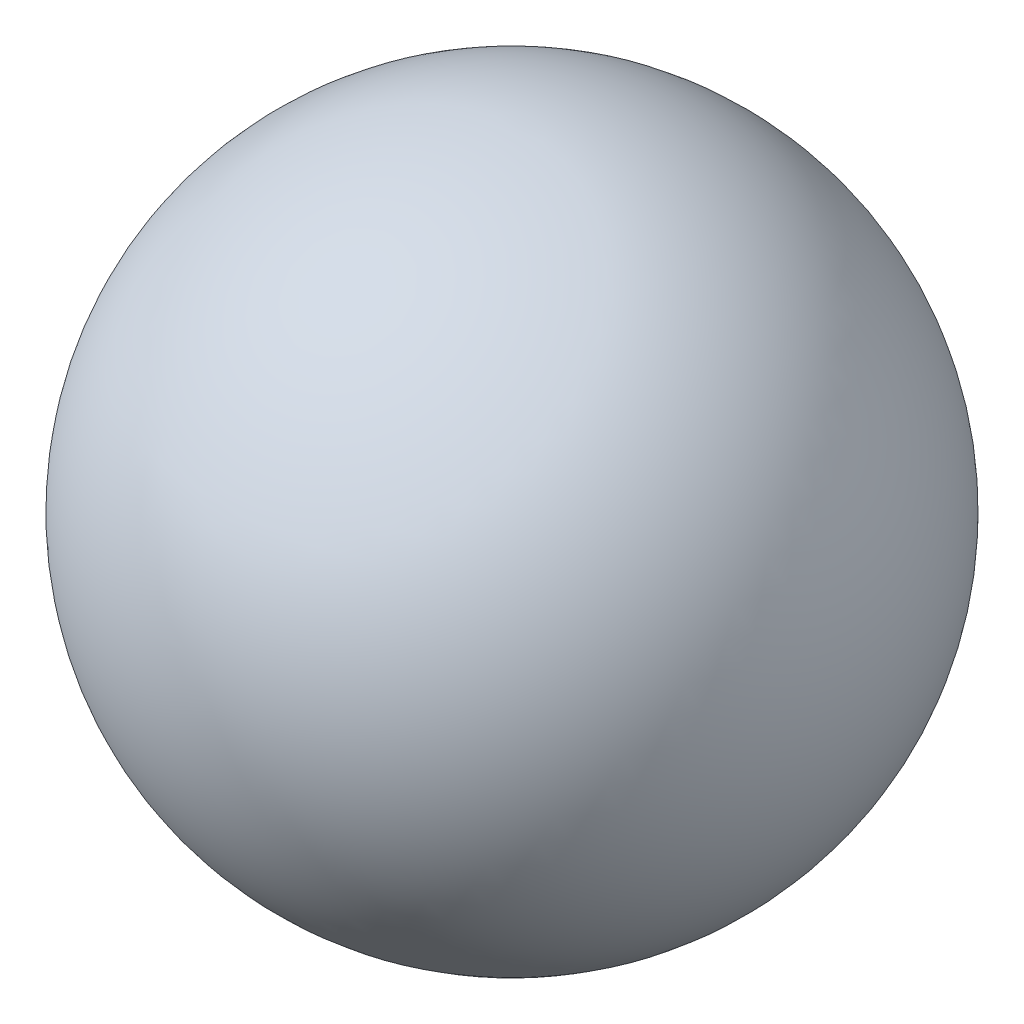
from build123d import *

# Parameters (mm, degrees)
CUT_EXTRUDE2_DEPTH      = 35.641016151
CUT_EXTRUDE2_DEPTH_BACK = 35.641016151
M10_TAPPED_HOLE1_D      = 8.5
M10_TAPPED_HOLE1_DEPTH  = 10
M10_TAPPED_HOLE1_TIP    = 2.553657631


with BuildPart() as part:
    # Sketch1 → Revolve1 (revolve)
    with BuildSketch(Plane(origin=(0, 0, 0), x_dir=(1, 0, 0), z_dir=(0, 1, 0))):
        with BuildLine():
            Line((0, 20), (0, -20))
            ThreePointArc((0, -20), (20, 0), (0, 20))
        make_face()
    revolve(axis=Axis((0, 0, -20), (0, 0, 1)))

    # Sketch2 → Cut-Extrude2 (cut, two sides: drawn at the far end of the back side and taken through both)
    with BuildSketch(Plane(origin=(0, 0, 0), x_dir=(0, 0, -1), z_dir=(1, 0, 0)).offset(-CUT_EXTRUDE2_DEPTH_BACK)):
        Polygon((-113.979792733, -18), (-8.717797887, -18), (8.717797887, -18), (113.979792733, -18), (113.979792733, -228.523989691), (-113.979792733, -228.523989691), align=None)
    extrude(amount=CUT_EXTRUDE2_DEPTH + CUT_EXTRUDE2_DEPTH_BACK, mode=Mode.SUBTRACT)

    # M10 Tapped Hole1
    with Locations(Plane(origin=(0, -18, 0), x_dir=(-1, 0, 0), z_dir=(0, -1, 0))):
        with Locations((0, 0)):
            Hole(M10_TAPPED_HOLE1_D / 2, depth=M10_TAPPED_HOLE1_DEPTH)
            with Locations((0, 0, -(M10_TAPPED_HOLE1_DEPTH + M10_TAPPED_HOLE1_TIP / 2))):  # 118° drill point
                Cone(0, M10_TAPPED_HOLE1_D / 2, M10_TAPPED_HOLE1_TIP, mode=Mode.SUBTRACT)


solid = part.part
